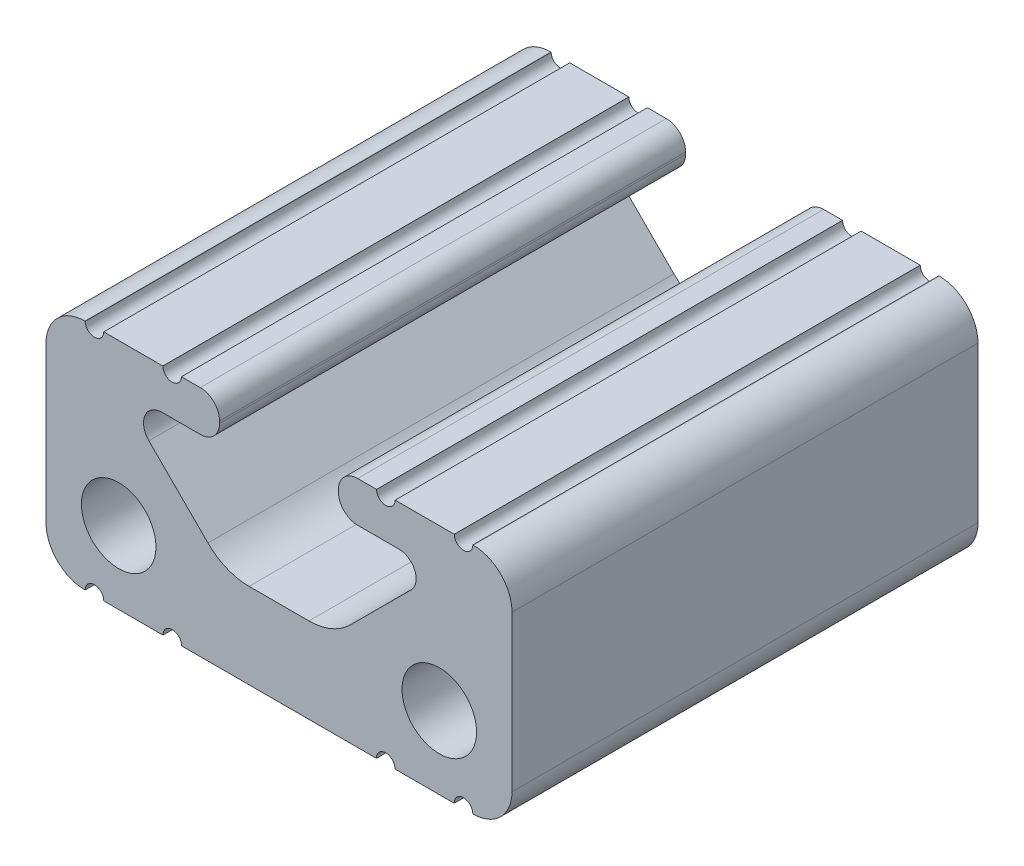
from build123d import *

# Parameters (mm, degrees)
SKETCH1_R      = 2.032
EXTRUDE1_DEPTH = 25.4


with BuildPart() as part:
    # Sketch1 → Extrude1 (new body)
    with BuildSketch(Plane.XY):
        with BuildLine():
            Line((9.551093887, 6.35), (6.330982008, 6.35))
            ThreePointArc((6.330982008, 6.35), (5.824379679, 5.843397671), (5.31777735, 6.35))
            Line((5.31777735, 6.35), (4.28752, 6.35))
            ThreePointArc((4.28752, 6.35), (3.545750844, 6.042749156), (3.2385, 5.30098))
            Line((3.2385, 5.30098), (3.2385, 5.18922))
            ThreePointArc((3.2385, 5.18922), (3.545750844, 4.447450844), (4.28752, 4.1402))
            Line((4.28752, 4.1402), (6.541264932, 4.1402))
            ThreePointArc((6.541264932, 4.1402), (7.403778411, 3.563601238), (7.200674335, 2.54618079))
            Line((7.200674335, 2.54618079), (3.874487735, -0.773919123))
            ThreePointArc((3.874487735, -0.773919123), (2.845157282, -1.460673567), (1.631480681, -1.7018))
            Line((1.631480681, -1.7018), (-1.631480681, -1.7018))
            ThreePointArc((-1.631480681, -1.7018), (-2.845157282, -1.460673567), (-3.874487735, -0.773919123))
            Line((-3.874487735, -0.773919123), (-7.091634343, 2.437340333))
            ThreePointArc((-7.091634343, 2.437340333), (-7.30860647, 3.524230776), (-6.387200124, 4.1402))
            Line((-6.387200124, 4.1402), (-4.28752, 4.1402))
            ThreePointArc((-4.28752, 4.1402), (-3.545750844, 4.447450844), (-3.2385, 5.18922))
            Line((-3.2385, 5.18922), (-3.2385, 5.30098))
            ThreePointArc((-3.2385, 5.30098), (-3.545750844, 6.042749156), (-4.28752, 6.35))
            Line((-4.28752, 6.35), (-5.319235427, 6.35))
            ThreePointArc((-5.319235427, 6.35), (-5.825837756, 5.843397671), (-6.332440085, 6.35))
            Line((-6.332440085, 6.35), (-9.552501021, 6.35))
            ThreePointArc((-9.552501021, 6.35), (-10.056951984, 5.843402239), (-10.565687406, 6.345697309))
            Line((-10.565687406, 6.345697309), (-10.590059723, 6.345701253))
            ThreePointArc((-10.590059723, 6.345701253), (-12.083428447, 5.727229281), (-12.7, 4.233074923))
            Line((-12.7, 4.233074923), (-12.7, -4.233074923))
            ThreePointArc((-12.7, -4.233074923), (-12.072915167, -5.733409532), (-10.564685825, -6.341261141))
            ThreePointArc((-10.564685825, -6.341261141), (-10.053713904, -5.834598435), (-9.551557924, -6.35))
            Line((-9.551557924, -6.35), (-6.323021107, -6.35))
            ThreePointArc((-6.323021107, -6.35), (-5.816495529, -5.83457959), (-5.309969951, -6.35))
            Line((-5.309969951, -6.35), (5.309969951, -6.35))
            ThreePointArc((5.309969951, -6.35), (5.816495529, -5.83457959), (6.323021107, -6.35))
            Line((6.323021107, -6.35), (9.550160942, -6.35))
            ThreePointArc((9.550160942, -6.35), (10.051855758, -5.834602622), (10.563288148, -6.340338775))
            Line((10.563288148, -6.340338775), (10.589922543, -6.34049468))
            ThreePointArc((10.589922543, -6.34049468), (12.081868228, -5.723579066), (12.7, -4.23213684))
            Line((12.7, -4.23213684), (12.7, 4.244714967))
            ThreePointArc((12.7, 4.244714967), (12.082100067, 5.735925507), (10.590578068, 6.353073239))
            Line((10.590578068, 6.353073239), (10.564289268, 6.353065837))
            ThreePointArc((10.564289268, 6.353065837), (10.059229141, 5.84339999), (9.551093887, 6.35))
        make_face()
        with Locations((8.7376, -2.3876)):
            Circle(SKETCH1_R, mode=Mode.SUBTRACT)
        with Locations((-8.7376, -2.3876)):
            Circle(SKETCH1_R, mode=Mode.SUBTRACT)
    extrude(amount=-EXTRUDE1_DEPTH)


solid = part.part
